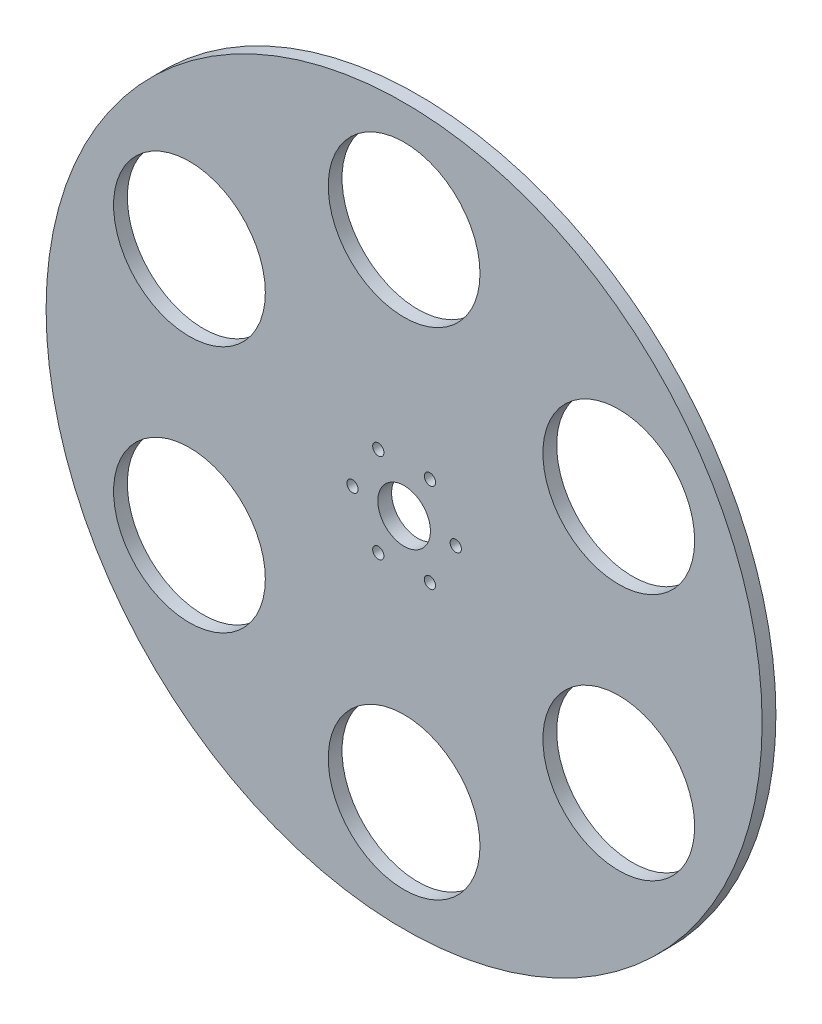
from build123d import *

# Parameters (mm, degrees)
SKETCH1_R           = 165.1
SKETCH1_R_2         = 34.9885
SKETCH1_R_3         = 12.1285
BOSS_EXTRUDE1_DEPTH = 3.175
SKETCH2_R           = 2.5908
CUT_EXTRUDE1_DEPTH  = 6.35


with BuildPart() as part:
    # Sketch1 → Boss-Extrude1 (new, symmetric)
    with BuildSketch(Plane.XY):
        Circle(SKETCH1_R)
        with Locations((0, 114.3)):
            Circle(SKETCH1_R_2, mode=Mode.SUBTRACT)
        with Locations((98.986703653, 57.15)):
            Circle(SKETCH1_R_2, mode=Mode.SUBTRACT)
        with Locations((98.986703653, -57.15)):
            Circle(SKETCH1_R_2, mode=Mode.SUBTRACT)
        with Locations((0, -114.3)):
            Circle(SKETCH1_R_2, mode=Mode.SUBTRACT)
        with Locations((-98.986703653, -57.15)):
            Circle(SKETCH1_R_2, mode=Mode.SUBTRACT)
        with Locations((-98.986703653, 57.15)):
            Circle(SKETCH1_R_2, mode=Mode.SUBTRACT)
        Circle(SKETCH1_R_3, mode=Mode.SUBTRACT)
    extrude(amount=BOSS_EXTRUDE1_DEPTH, both=True)

    # Sketch2 → Cut-Extrude1 (cut)
    with BuildSketch(Plane(origin=(0, 0, -3.175), x_dir=(-1, 0, 0), z_dir=(0, 0, -1))):
        with Locations((-23.8125, 0)):
            Circle(SKETCH2_R)
        with Locations((-11.90625, 20.622229928)):
            Circle(SKETCH2_R)
        with Locations((11.90625, 20.622229928)):
            Circle(SKETCH2_R)
        with Locations((23.8125, 0)):
            Circle(SKETCH2_R)
        with Locations((11.90625, -20.622229928)):
            Circle(SKETCH2_R)
        with Locations((-11.90625, -20.622229928)):
            Circle(SKETCH2_R)
    extrude(amount=-CUT_EXTRUDE1_DEPTH, mode=Mode.SUBTRACT)


solid = part.part
